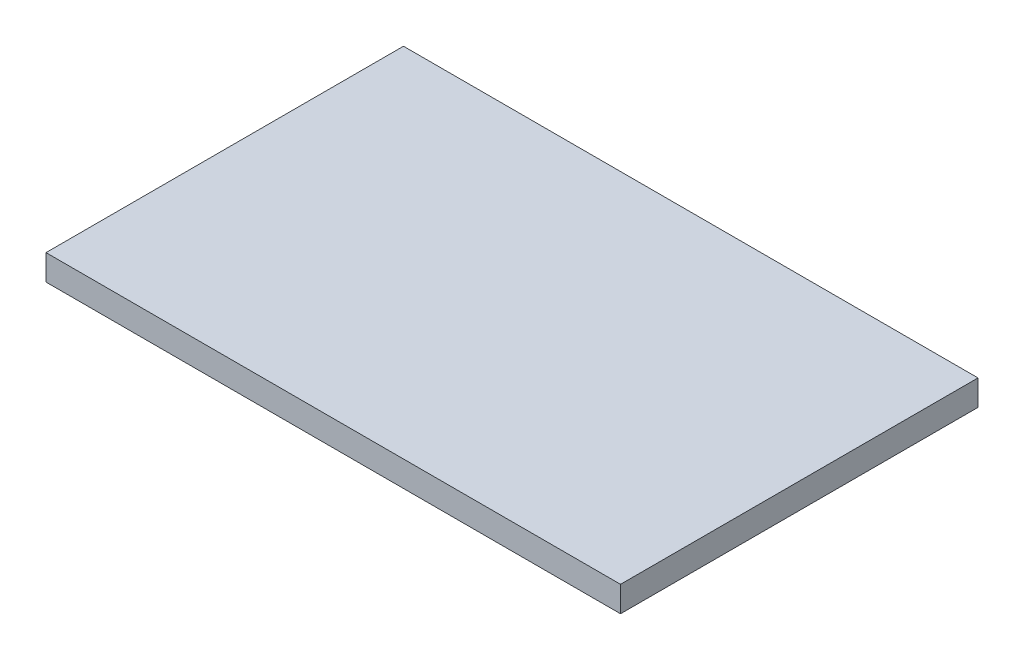
from build123d import *

# Parameters (mm, degrees)
SKETCH1_W           = 1125
SKETCH1_H           = 700
BOSS_EXTRUDE1_DEPTH = 25


with BuildPart() as part:
    # Sketch1 → Boss-Extrude1 (new, symmetric)
    with BuildSketch(Plane(origin=(0, 0, 0), x_dir=(1, 0, 0), z_dir=(0, 1, 0))):
        Rectangle(SKETCH1_W, SKETCH1_H)
    extrude(amount=BOSS_EXTRUDE1_DEPTH, both=True)


solid = part.part
